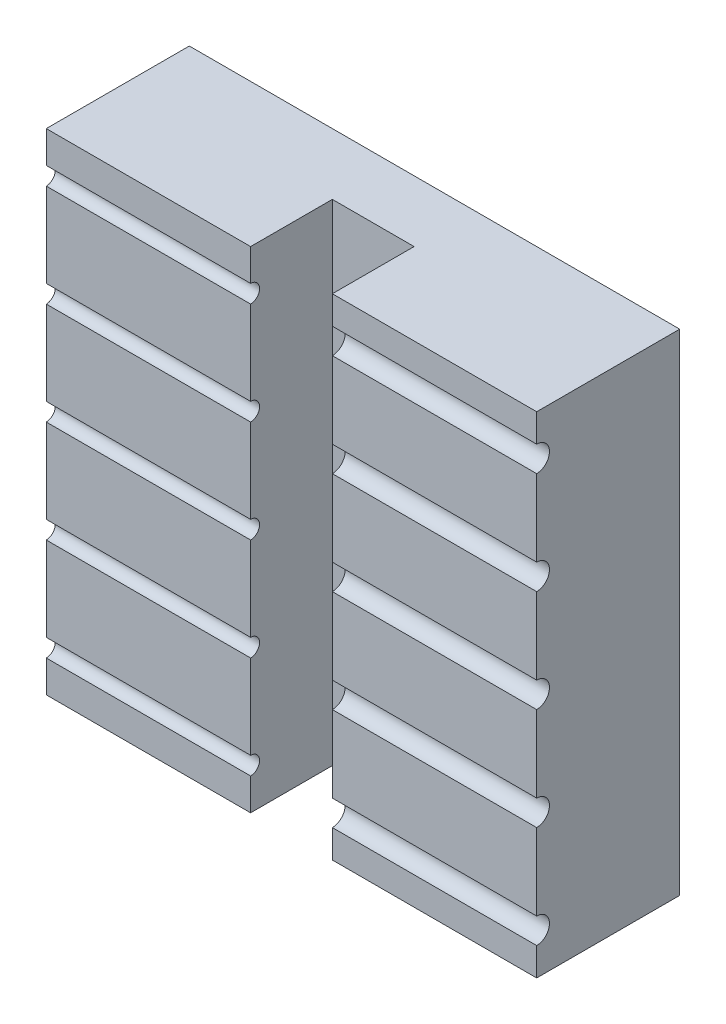
from build123d import *

# Parameters (mm, degrees)
SKETCH1_W           = 48
SKETCH1_H           = 48
BOSS_EXTRUDE1_DEPTH = 6
SKETCH1_3_W         = 20
SKETCH1_3_H         = 48
BOSS_EXTRUDE2_DEPTH = 14
SKETCH2_R           = 0.875
CUT_EXTRUDE1_DEPTH  = 25
SKETCH3_R           = 1.25
CUT_EXTRUDE2_DEPTH  = 25


with BuildPart() as part:
    # Sketch1 → Boss-Extrude1 (new body)
    with BuildSketch(Plane.XY):
        Rectangle(SKETCH1_W, SKETCH1_H)
    extrude(amount=BOSS_EXTRUDE1_DEPTH)

    # Sketch1<3> → Boss-Extrude2 (add)
    with BuildSketch(Plane.XY):
        with Locations((-14, 0)):
            Rectangle(SKETCH1_3_W, SKETCH1_3_H)
        with Locations((14, 0)):
            Rectangle(SKETCH1_3_W, SKETCH1_3_H)
    extrude(amount=BOSS_EXTRUDE2_DEPTH)

    # Sketch2 → Cut-Extrude1 (cut)
    with BuildSketch(Plane.ZY.offset(24)):
        with Locations((14, 0)):
            Circle(SKETCH2_R)
        with Locations((14, 10)):
            Circle(SKETCH2_R)
        with Locations((14, 20)):
            Circle(SKETCH2_R)
        with Locations((14, -10)):
            Circle(SKETCH2_R)
        with Locations((14, -20)):
            Circle(SKETCH2_R)
    extrude(amount=-CUT_EXTRUDE1_DEPTH, mode=Mode.SUBTRACT)

    # Sketch3 → Cut-Extrude2 (cut)
    with BuildSketch(Plane(origin=(24, 0, 0), x_dir=(0, 0, -1), z_dir=(1, 0, 0))):
        with Locations((-14, 0)):
            Circle(SKETCH3_R)
        with Locations((-14, -10)):
            Circle(SKETCH3_R)
        with Locations((-14, -20)):
            Circle(SKETCH3_R)
        with Locations((-14, 10)):
            Circle(SKETCH3_R)
        with Locations((-14, 20)):
            Circle(SKETCH3_R)
    extrude(amount=-CUT_EXTRUDE2_DEPTH, mode=Mode.SUBTRACT)


solid = part.part
